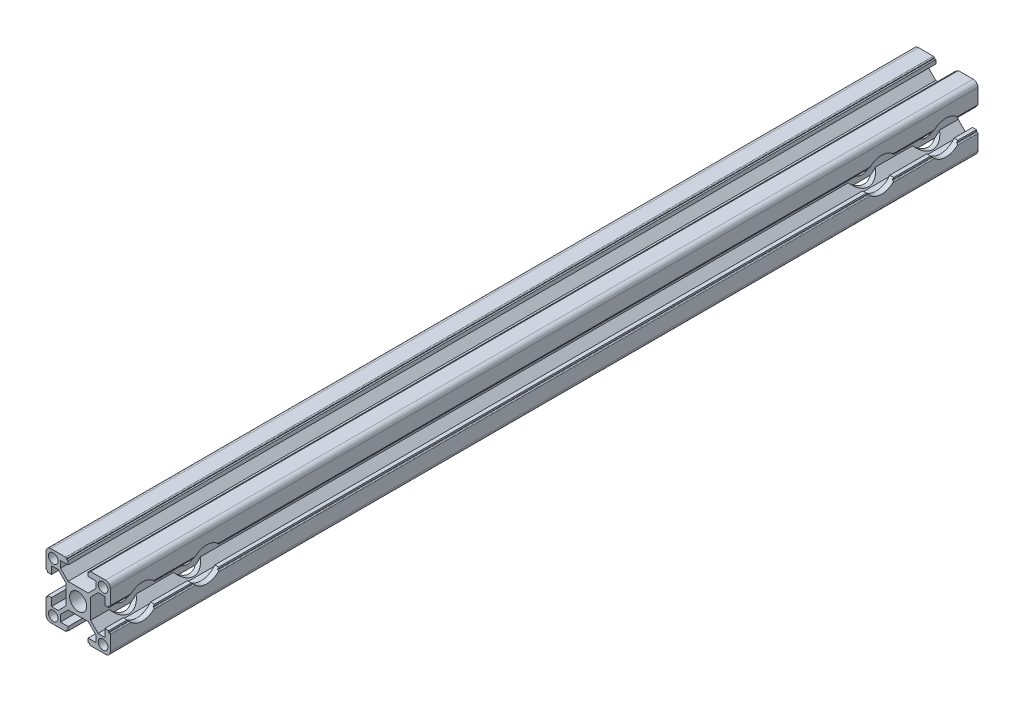
from build123d import *

# Parameters (mm, degrees)
SKETCH_1_R          = 2.65
SKETCH_1_R_2        = 1.5
EXTRUDE_1_DEPTH     = 135
SKETCH_4_R          = 3.1
CUT_EXTRUDE_3_DEPTH = 137.076531775
SKETCH_5_R          = 5.25
CUT_EXTRUDE_4_DEPTH = 137.076531875
SKETCH_6_R          = 3.1
CUT_EXTRUDE_5_DEPTH = 137.076531875
SKETCH_7_R          = 5.25
CUT_EXTRUDE_6_DEPTH = 137.076531875


with BuildPart() as part:
    # 草图1 → 凸台-拉伸1 (new, symmetric)
    with BuildSketch(Plane.XY):
        with BuildLine():
            Line((3.142893219, 3.85), (-3.142893219, 3.85))
            Line((-3.142893219, 3.85), (-5.5, 6.207106781))
            Line((-5.5, 6.207106781), (-5.5, 8.3))
            Line((-5.5, 8.3), (-3.1, 8.3))
            Line((-3.1, 8.3), (-3.1, 9.5))
            Line((-3.1, 9.5), (-3.6, 9.5))
            Line((-3.6, 9.5), (-3.6, 9.7))
            ThreePointArc((-3.6, 9.7), (-3.687867966, 9.912132034), (-3.9, 10))
            Line((-3.9, 10), (-8.5, 10))
            ThreePointArc((-8.5, 10), (-9.560660172, 9.560660172), (-10, 8.5))
            Line((-10, 8.5), (-10, 3.9))
            ThreePointArc((-10, 3.9), (-9.912132034, 3.687867966), (-9.7, 3.6))
            Line((-9.7, 3.6), (-9.5, 3.6))
            Line((-9.5, 3.6), (-9.5, 3.1))
            Line((-9.5, 3.1), (-8.3, 3.1))
            Line((-8.3, 3.1), (-8.3, 5.5))
            Line((-8.3, 5.5), (-6.207106781, 5.5))
            Line((-6.207106781, 5.5), (-3.85, 3.142893219))
            Line((-3.85, 3.142893219), (-3.85, -3.142893219))
            Line((-3.85, -3.142893219), (-6.207106781, -5.5))
            Line((-6.207106781, -5.5), (-8.3, -5.5))
            Line((-8.3, -5.5), (-8.3, -3.1))
            Line((-8.3, -3.1), (-9.5, -3.1))
            Line((-9.5, -3.1), (-9.5, -3.6))
            Line((-9.5, -3.6), (-9.7, -3.6))
            ThreePointArc((-9.7, -3.6), (-9.912132034, -3.687867966), (-10, -3.9))
            Line((-10, -3.9), (-10, -8.5))
            ThreePointArc((-10, -8.5), (-9.560660172, -9.560660172), (-8.5, -10))
            Line((-8.5, -10), (-3.9, -10))
            ThreePointArc((-3.9, -10), (-3.687867966, -9.912132034), (-3.6, -9.7))
            Line((-3.6, -9.7), (-3.6, -9.5))
            Line((-3.6, -9.5), (-3.1, -9.5))
            Line((-3.1, -9.5), (-3.1, -8.3))
            Line((-3.1, -8.3), (-5.5, -8.3))
            Line((-5.5, -8.3), (-5.5, -6.207106781))
            Line((-5.5, -6.207106781), (-3.142893219, -3.85))
            Line((-3.142893219, -3.85), (3.142893219, -3.85))
            Line((3.142893219, -3.85), (5.5, -6.207106781))
            Line((5.5, -6.207106781), (5.5, -8.3))
            Line((5.5, -8.3), (3.1, -8.3))
            Line((3.1, -8.3), (3.1, -9.5))
            Line((3.1, -9.5), (3.6, -9.5))
            Line((3.6, -9.5), (3.6, -9.7))
            ThreePointArc((3.6, -9.7), (3.687867966, -9.912132034), (3.9, -10))
            Line((3.9, -10), (8.5, -10))
            ThreePointArc((8.5, -10), (9.560660172, -9.560660172), (10, -8.5))
            Line((10, -8.5), (10, -3.9))
            ThreePointArc((10, -3.9), (9.912132034, -3.687867966), (9.7, -3.6))
            Line((9.7, -3.6), (9.5, -3.6))
            Line((9.5, -3.6), (9.5, -3.1))
            Line((9.5, -3.1), (8.3, -3.1))
            Line((8.3, -3.1), (8.3, -5.5))
            Line((8.3, -5.5), (6.207106781, -5.5))
            Line((6.207106781, -5.5), (3.85, -3.142893219))
            Line((3.85, -3.142893219), (3.85, 3.142893219))
            Line((3.85, 3.142893219), (6.207106781, 5.5))
            Line((6.207106781, 5.5), (8.3, 5.5))
            Line((8.3, 5.5), (8.3, 3.1))
            Line((8.3, 3.1), (9.5, 3.1))
            Line((9.5, 3.1), (9.5, 3.6))
            Line((9.5, 3.6), (9.7, 3.6))
            ThreePointArc((9.7, 3.6), (9.912132034, 3.687867966), (10, 3.9))
            Line((10, 3.9), (10, 8.5))
            ThreePointArc((10, 8.5), (9.560660172, 9.560660172), (8.5, 10))
            Line((8.5, 10), (3.9, 10))
            ThreePointArc((3.9, 10), (3.687867966, 9.912132034), (3.6, 9.7))
            Line((3.6, 9.7), (3.6, 9.5))
            Line((3.6, 9.5), (3.1, 9.5))
            Line((3.1, 9.5), (3.1, 8.3))
            Line((3.1, 8.3), (5.5, 8.3))
            Line((5.5, 8.3), (5.5, 6.207106781))
            Line((5.5, 6.207106781), (3.142893219, 3.85))
        make_face()
        Circle(SKETCH_1_R, mode=Mode.SUBTRACT)
        with Locations((-7.75, 7.75)):
            Circle(SKETCH_1_R_2, mode=Mode.SUBTRACT)
        with Locations((7.75, 7.75)):
            Circle(SKETCH_1_R_2, mode=Mode.SUBTRACT)
        with Locations((7.75, -7.75)):
            Circle(SKETCH_1_R_2, mode=Mode.SUBTRACT)
        with Locations((-7.75, -7.75)):
            Circle(SKETCH_1_R_2, mode=Mode.SUBTRACT)
    extrude(amount=EXTRUDE_1_DEPTH, both=True)

    # 草图4 → 切除-拉伸3 (cut, through all)
    with BuildSketch(Plane(origin=(3.85, 0, 0), x_dir=(0, 0, -1), z_dir=(1, 0, 0))):
        with Locations((125, 0)):
            Circle(SKETCH_4_R)
        with Locations((105, 0)):
            Circle(SKETCH_4_R)
    extrude(amount=-CUT_EXTRUDE_3_DEPTH, mode=Mode.SUBTRACT)

    # 草图5 → 切除-拉伸4 (cut, through all)
    with BuildSketch(Plane(origin=(3.85, 0, 0), x_dir=(0, 0, -1), z_dir=(1, 0, 0))):
        with Locations((105, 0)):
            Circle(SKETCH_5_R)
        with Locations((125, 0)):
            Circle(SKETCH_5_R)
    extrude(amount=CUT_EXTRUDE_4_DEPTH, mode=Mode.SUBTRACT)

    # 草图6 → 切除-拉伸5 (cut, through all)
    with BuildSketch(Plane(origin=(3.85, 0, 0), x_dir=(0, 0, -1), z_dir=(1, 0, 0))):
        with Locations((-105, 0)):
            Circle(SKETCH_6_R)
        with Locations((-125, 0)):
            Circle(SKETCH_6_R)
    extrude(amount=-CUT_EXTRUDE_5_DEPTH, mode=Mode.SUBTRACT)

    # 草图7 → 切除-拉伸6 (cut, through all)
    with BuildSketch(Plane(origin=(3.85, 0, 0), x_dir=(0, 0, -1), z_dir=(1, 0, 0))):
        with Locations((-105, 0)):
            Circle(SKETCH_7_R)
        with Locations((-125, 0)):
            Circle(SKETCH_7_R)
    extrude(amount=CUT_EXTRUDE_6_DEPTH, mode=Mode.SUBTRACT)


solid = part.part
